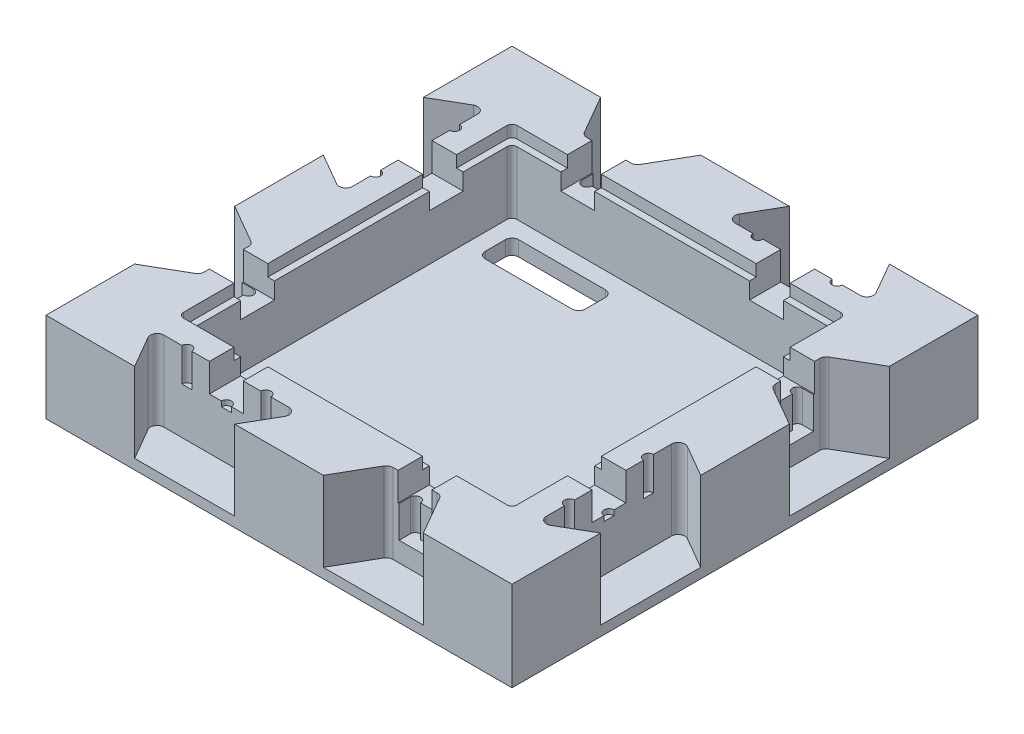
from build123d import *

# Parameters (mm, degrees)
SKETCH1_W                = 139.7
SKETCH1_H                = 139.7
BOSS_EXTRUDE1_DEPTH      = 13.45
CUT_EXTRUDE2_START       = -23.9
CUT_EXTRUDE2_DEPTH       = 127.279954093
CUT_EXTRUDE3_DEPTH       = 10
SKETCH6_W                = 10.16
SKETCH6_H                = 8.475
CUT_EXTRUDE4_DEPTH       = 20
SKETCH7_W                = 9.53
SKETCH7_H                = 9.53
CUT_EXTRUDE5_DEPTH       = 3.375
CUT_EXTRUDE6_DEPTH       = 9.53
FILLET1_R                = 2
CIRPATTERN1_COUNT        = 4
FILLET1_OF_CIRPATTERN1_R = 2
SKETCH9_W                = 100
SKETCH9_H                = 100
CUT_EXTRUDE7_DEPTH       = 22.4
SKETCH10_W               = 100
SKETCH10_H               = 100
SKETCH10_W_2             = 96
SKETCH10_H_2             = 96
BOSS_EXTRUDE2_DEPTH      = 18.9
SKETCH12_W               = 10.16
SKETCH12_H               = 4.975
CUT_EXTRUDE9_DEPTH       = 10
CIRPATTERN4_COUNT        = 4
SKETCH11_W               = 30
SKETCH11_H               = 10
CUT_EXTRUDE8_DEPTH       = 102.290695525
FILLET2_R                = 2
CIRPATTERN3_COUNT        = 2
FILLET2_OF_CIRPATTERN3_R = 2
FILLET3_R                = 1.5


with BuildPart() as part:
    # Sketch1 → Boss-Extrude1 (new, symmetric)
    with BuildSketch(Plane(origin=(0, 0, 0), x_dir=(1, 0, 0), z_dir=(0, 1, 0))):
        Rectangle(SKETCH1_W, SKETCH1_H)
    extrude(amount=BOSS_EXTRUDE1_DEPTH, both=True)

    # Sketch4 → Cut-Extrude2 (cut)
    with BuildSketch(Plane(origin=(0, 13.45, 0), x_dir=(1, 0, 0), z_dir=(0, 1, 0)).offset(CUT_EXTRUDE2_START)):
        Polygon((-43.283333333, -69.85), (-50.500211698, -57.35), (-6.066454968, -57.35), (-13.283333333, -69.85), align=None)
        Polygon((43.283333333, -69.85), (36.066454968, -57.35), (20.500211698, -57.35), (13.283333333, -69.85), align=None)
    cut_extrude2 = extrude(amount=CUT_EXTRUDE2_DEPTH, mode=Mode.SUBTRACT)

    # Sketch5 → Cut-Extrude3 (cut)
    with BuildSketch(Plane(origin=(0, 13.45, 0), x_dir=(1, 0, 0), z_dir=(0, 1, 0))):
        with BuildLine():
            Line((-41.641772516, -57.35), (-38.641772516, -57.35))
            ThreePointArc((-38.641772516, -57.35), (-40.141772516, -55.85), (-41.641772516, -57.35))
        make_face()
        with BuildLine():
            Line((-17.924894151, -57.35), (-14.924894151, -57.35))
            ThreePointArc((-14.924894151, -57.35), (-16.424894151, -55.85), (-17.924894151, -57.35))
        make_face()
        with BuildLine():
            Line((-29.783333333, -57.35), (-26.783333333, -57.35))
            ThreePointArc((-26.783333333, -57.35), (-28.283333333, -55.85), (-29.783333333, -57.35))
        make_face()
    cut_extrude3 = extrude(amount=-CUT_EXTRUDE3_DEPTH, mode=Mode.SUBTRACT)

    # Sketch6 → Cut-Extrude4 (cut)
    with BuildSketch(Plane.XY.offset(57.35)):
        with Locations((28.283333333, 9.2125)):
            Rectangle(SKETCH6_W, SKETCH6_H)
        with Locations((-28.283333333, 9.2125)):
            Rectangle(SKETCH6_W, SKETCH6_H)
    cut_extrude4 = extrude(amount=-CUT_EXTRUDE4_DEPTH, mode=Mode.SUBTRACT)

    # Sketch7 → Cut-Extrude5 (cut)
    with BuildSketch(Plane.XY.offset(57.35)):
        with Locations((28.283333333, 0.21)):
            Rectangle(SKETCH7_W, SKETCH7_H)
    cut_extrude5 = extrude(amount=-CUT_EXTRUDE5_DEPTH, mode=Mode.SUBTRACT)

    # Sketch8 → Cut-Extrude6 (cut)
    with BuildSketch(Plane(origin=(0, 4.975, 0), x_dir=(1, 0, 0), z_dir=(0, 1, 0))):
        with BuildLine():
            Line((23.518333333, -53.975), (26.518333333, -53.975))
            ThreePointArc((26.518333333, -53.975), (25.018333333, -52.475), (23.518333333, -53.975))
        make_face()
        with BuildLine():
            Line((30.048333333, -53.975), (33.048333333, -53.975))
            ThreePointArc((33.048333333, -53.975), (31.548333333, -52.475), (30.048333333, -53.975))
        make_face()
    cut_extrude6 = extrude(amount=-CUT_EXTRUDE6_DEPTH, mode=Mode.SUBTRACT)

    # Fillet1
    fillet1_edges = [part.edges().sort_by_distance(p)[0] for p in [
        (-6.066454968, 1.5, 57.35),
        (-50.500211698, 1.5, 57.35),
        (36.066454968, 1.5, 57.35),
        (20.500211698, 1.5, 57.35),
    ]]
    fillet(fillet1_edges, radius=FILLET1_R)

    # CirPattern1: Cut-Extrude2, Cut-Extrude3, Cut-Extrude4, Cut-Extrude5, Cut-Extrude6 ×4 about axis
    cirpattern1_axis = Axis((0, 0, 0), (0, 1, 0))
    add([cut_extrude2.rotate(cirpattern1_axis, i * 360 / CIRPATTERN1_COUNT) for i in range(1, CIRPATTERN1_COUNT)], mode=Mode.SUBTRACT)
    add([cut_extrude3.rotate(cirpattern1_axis, i * 360 / CIRPATTERN1_COUNT) for i in range(1, CIRPATTERN1_COUNT)], mode=Mode.SUBTRACT)
    add([cut_extrude4.rotate(cirpattern1_axis, i * 360 / CIRPATTERN1_COUNT) for i in range(1, CIRPATTERN1_COUNT)], mode=Mode.SUBTRACT)
    add([cut_extrude5.rotate(cirpattern1_axis, i * 360 / CIRPATTERN1_COUNT) for i in range(1, CIRPATTERN1_COUNT)], mode=Mode.SUBTRACT)
    add([cut_extrude6.rotate(cirpattern1_axis, i * 360 / CIRPATTERN1_COUNT) for i in range(1, CIRPATTERN1_COUNT)], mode=Mode.SUBTRACT)

    # Fillet1 of CirPattern1
    fillet1_of_cirpattern1_edges = [part.edges().sort_by_distance(p)[0] for p in [
        (57.35, 1.5, 6.066454968),
        (57.35, 1.5, 50.500211698),
        (57.35, 1.5, -36.066454968),
        (57.35, 1.5, -20.500211698),
        (6.066454968, 1.5, -57.35),
        (50.500211698, 1.5, -57.35),
        (-36.066454968, 1.5, -57.35),
        (-20.500211698, 1.5, -57.35),
        (-57.35, 1.5, -6.066454968),
        (-57.35, 1.5, -50.500211698),
        (-57.35, 1.5, 36.066454968),
        (-57.35, 1.5, 20.500211698),
    ]]
    fillet(fillet1_of_cirpattern1_edges, radius=FILLET1_OF_CIRPATTERN1_R)

    # Sketch9 → Cut-Extrude7 (cut)
    with BuildSketch(Plane(origin=(0, 13.45, 0), x_dir=(1, 0, 0), z_dir=(0, 1, 0))):
        Rectangle(SKETCH9_W, SKETCH9_H)
    extrude(amount=-CUT_EXTRUDE7_DEPTH, mode=Mode.SUBTRACT)

    # Sketch10 → Boss-Extrude2 (add)
    with BuildSketch(Plane(origin=(0, -8.95, 0), x_dir=(1, 0, 0), z_dir=(0, 1, 0))):
        Rectangle(SKETCH10_W, SKETCH10_H)
        Rectangle(SKETCH10_W_2, SKETCH10_H_2, mode=Mode.SUBTRACT)
    extrude(amount=BOSS_EXTRUDE2_DEPTH)

    # Sketch12 → Cut-Extrude9 (cut)
    with BuildSketch(Plane.XY.offset(50)):
        with Locations((28.283333333, 7.4625)):
            Rectangle(SKETCH12_W, SKETCH12_H)
        with Locations((-28.283333333, 7.4625)):
            Rectangle(SKETCH12_W, SKETCH12_H)
    cut_extrude9 = extrude(amount=-CUT_EXTRUDE9_DEPTH, mode=Mode.SUBTRACT)

    # CirPattern4: Cut-Extrude9 ×4 about axis
    cirpattern4_axis = Axis((0, 31.646383285, 0), (0, -1, 0))
    for i in range(1, CIRPATTERN4_COUNT):
        add(cut_extrude9.rotate(cirpattern4_axis, i * 360 / CIRPATTERN4_COUNT), mode=Mode.SUBTRACT)

    # Sketch11 → Cut-Extrude8 (cut, symmetric)
    with BuildSketch(Plane(origin=(0, -8.95, 0), x_dir=(1, 0, 0), z_dir=(0, 1, 0))):
        with Locations((-28, 38)):
            Rectangle(SKETCH11_W, SKETCH11_H)
    cut_extrude8 = extrude(amount=CUT_EXTRUDE8_DEPTH, both=True, mode=Mode.SUBTRACT)

    # Fillet2
    fillet2_edges = [part.edges().sort_by_distance(p)[0] for p in [
        (-43, -11.2, -33),
        (-43, -11.2, -43),
        (-13, -11.2, -43),
        (-13, -11.2, -33),
    ]]
    fillet(fillet2_edges, radius=FILLET2_R)

    # CirPattern3: Cut-Extrude8 ×2 about axis
    cirpattern3_axis = Axis((0, 0, 0), (0, 1, 0))
    for i in range(1, CIRPATTERN3_COUNT):
        add(cut_extrude8.rotate(cirpattern3_axis, i * 360 / CIRPATTERN3_COUNT), mode=Mode.SUBTRACT)

    # Fillet2 of CirPattern3
    fillet2_of_cirpattern3_edges = [part.edges().sort_by_distance(p)[0] for p in [
        (43, -11.2, 33),
        (43, -11.2, 43),
        (13, -11.2, 43),
        (13, -11.2, 33),
    ]]
    fillet(fillet2_of_cirpattern3_edges, radius=FILLET2_OF_CIRPATTERN3_R)

    # Fillet3
    fillet3_edges = [part.edges().sort_by_distance(p)[0] for p in [
        (50, 11.7, -50),
        (50, 11.7, 50),
        (-50, 11.7, 50),
        (-50, 11.7, -50),
        (48, 0.5, -48),
        (-48, 0.5, -48),
        (-48, 0.5, 48),
        (48, 0.5, 48),
    ]]
    fillet(fillet3_edges, radius=FILLET3_R)


solid = part.part
